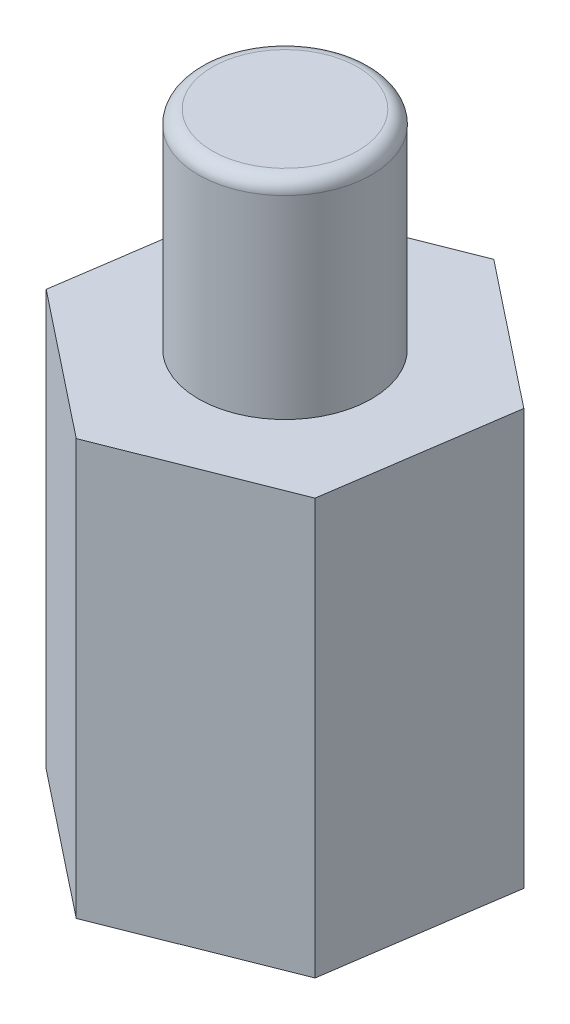
from build123d import *

# Parameters (mm, degrees)
SALIENTE_EXTRUIR1_DEPTH = 6
CROQUIS_CARA_R          = 1.25
SALIENTE_EXTRUIR2_DEPTH = 3
REDONDEO1_R             = 0.2
CROQUIS1_R              = 1.25
CORTAR_EXTRUIR1_DEPTH   = 3


with BuildPart() as part:
    # Croquis base → Saliente-Extruir1 (new body)
    with BuildSketch(Plane(origin=(0, 0, 0), x_dir=(1, 0, 0), z_dir=(0, 1, 0))):
        Polygon((2.082277712, -1.648469855), (2.468755628, 0.979070469), (0.386477916, 2.627540324), (-2.082277712, 1.648469855), (-2.468755628, -0.979070469), (-0.386477916, -2.627540324), align=None)
    extrude(amount=SALIENTE_EXTRUIR1_DEPTH)

    # Croquis cara → Saliente-Extruir2 (add)
    with BuildSketch(Plane(origin=(0, 6, 0), x_dir=(1, 0, 0), z_dir=(0, 1, 0))):
        with Locations(Location((0, 0, 0), (0, 0, 270))):
            Circle(CROQUIS_CARA_R)
    extrude(amount=SALIENTE_EXTRUIR2_DEPTH)

    # Redondeo1
    redondeo1_edges = [part.edges().sort_by_distance(p)[0] for p in [
        (0, 9, -1.25),
    ]]
    fillet(redondeo1_edges, radius=REDONDEO1_R)

    # Croquis1 → Cortar-Extruir1 (cut)
    with BuildSketch(Plane.XZ):
        with Locations(Location((0, 0, 0), (0, 0, 90))):
            Circle(CROQUIS1_R)
    extrude(amount=-CORTAR_EXTRUIR1_DEPTH, mode=Mode.SUBTRACT)


solid = part.part
